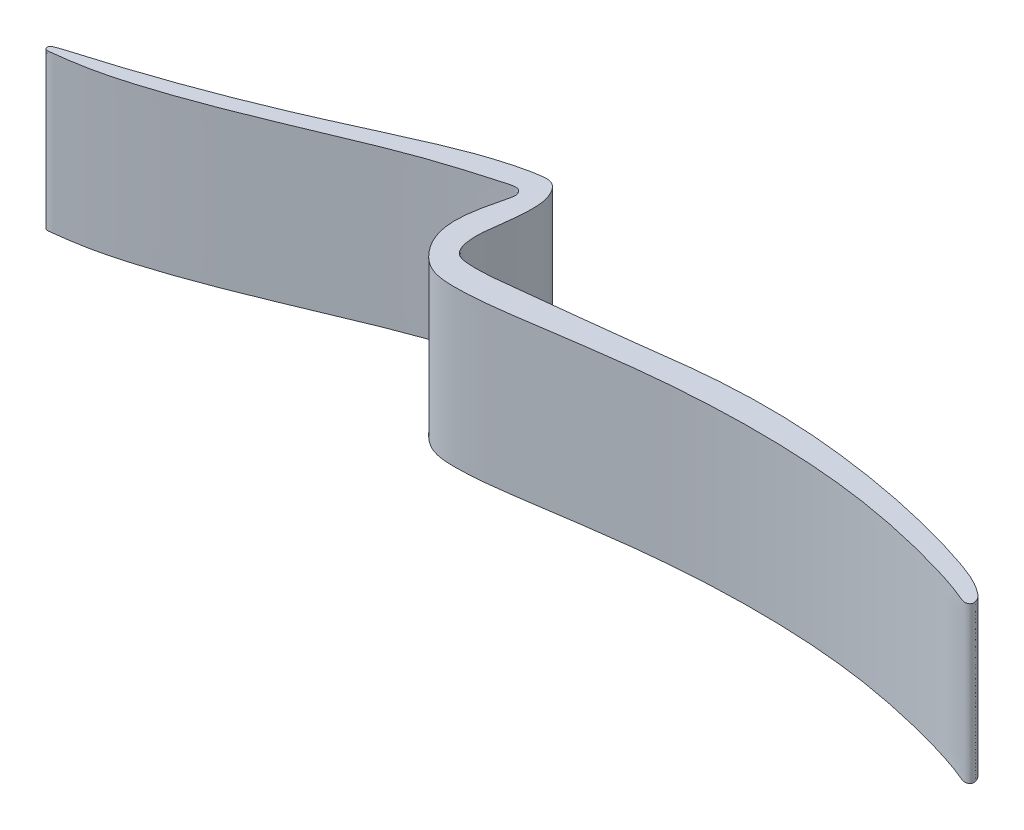
from build123d import *

# Parameters (mm, degrees)
BOSS_EXTRUDE1_DEPTH = 12.7


with BuildPart() as part:
    # Sketch1 → Boss-Extrude1 (new body)
    with BuildSketch(Plane(origin=(0, 0, 0), x_dir=(1, 0, 0), z_dir=(0, 1, 0))):
        with BuildLine():
            add(Edge.make_bspline(
                [(1.654481527, 44.877776846), (3.107472455, 45.303753616), (8.044150825, 46.837590328), (15.060724914, 49.548764854), (21.279830864, 52.479028242), (25.314320016, 54.184337896), (27.644188662, 54.922005934), (29.465279187, 55.330628751), (30.752140414, 55.485816673), (31.712557284, 54.242049801), (31.840848698, 52.446200096), (31.573830563, 50.202461642), (31.28942262, 48.292053403), (31.620044741, 46.935713988), (32.049752032, 46.401938195), (32.631355264, 46.207302373), (34.331387639, 46.072157495), (36.626240054, 46.425948728), (40.140295568, 46.794126959), (44.656229954, 47.261557887), (50.641662511, 48.168448342), (57.678758659, 48.359706221), (65.469528671, 47.453604731), (71.948668988, 45.943177033), (76.298763706, 44.356138502), (77.476153353, 43.341686462), (77.72715537, 42.673078951), (77.165443081, 42.460111141), (76.238541481, 42.867084038), (74.206948812, 43.588600557), (70.376883642, 44.647592218), (64.930811567, 45.728765841), (56.936221478, 46.32070382), (48.088353391, 45.85882968), (40.121022, 44.559801359), (35.103588639, 43.895043143), (32.111598649, 44.032462451), (30.459139847, 45.410342784), (29.38638398, 47.339398244), (29.429637296, 49.952108469), (29.933456662, 51.793298387), (30.211584066, 53.010295751), (29.816879793, 53.661495533), (27.390863896, 52.973458402), (23.302054152, 51.798635581), (16.802847458, 49.019036192), (10.396254281, 46.378428995), (4.863603514, 44.630238724), (2.301235307, 44.241997481), (0.568742883, 44.007240652), (0.58561976, 44.465598748), (1.008604038, 44.689709442), (1.364653642, 44.792807323), (1.654481527, 44.877776846)],
                knots=[0, 0, 0, 0, 0.026347456, 0.087136849, 0.128901454, 0.143417707, 0.162034958, 0.170062644, 0.176070936, 0.182307422, 0.193936288, 0.206211546, 0.221045393, 0.226360889, 0.229572167, 0.232203249, 0.236550426, 0.258644585, 0.271450962, 0.296940515, 0.336088526, 0.374682257, 0.416795, 0.469021238, 0.490138374, 0.492247155, 0.496600759, 0.498436062, 0.500951845, 0.513471763, 0.53561698, 0.56845694, 0.608190008, 0.672033929, 0.719363745, 0.745275545, 0.759551756, 0.767986349, 0.780839235, 0.79594085, 0.81090096, 0.814042954, 0.816634171, 0.822197187, 0.850447345, 0.896654409, 0.937992196, 0.972540381, 0.988234626, 0.992414949, 0.993508275, 0.994744477, 1, 1, 1, 1], degree=3))
        make_face()
    extrude(amount=BOSS_EXTRUDE1_DEPTH)


solid = part.part
